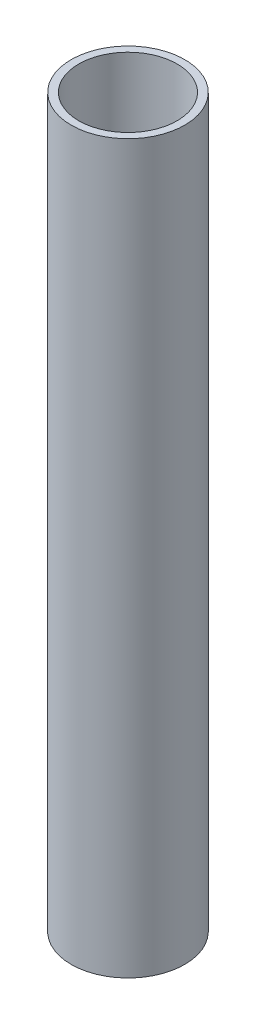
from build123d import *

# Parameters (mm, degrees)
SKETCH1_R           = 7.5
SKETCH1_R_2         = 6.5
BOSS_EXTRUDE1_DEPTH = 96


with BuildPart() as part:
    # Sketch1 → Boss-Extrude1 (new body)
    with BuildSketch(Plane(origin=(0, 0, 0), x_dir=(1, 0, 0), z_dir=(0, 1, 0))):
        with Locations(Location((0, 0, 0), (0, 0, 270))):
            Circle(SKETCH1_R)
        with Locations(Location((0, 0, 0), (0, 0, 270))):
            Circle(SKETCH1_R_2, mode=Mode.SUBTRACT)
    extrude(amount=BOSS_EXTRUDE1_DEPTH)


solid = part.part
